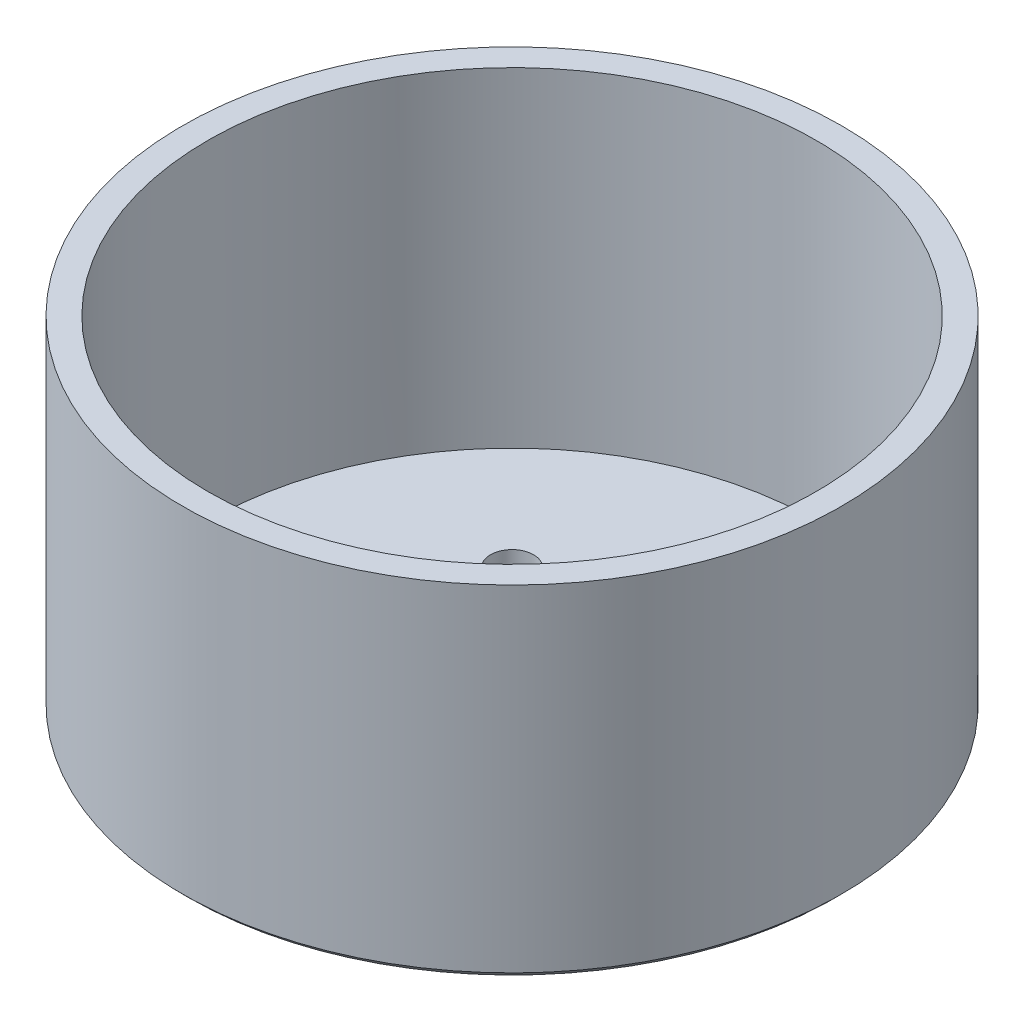
from build123d import *
from build123d.topology import SkipClean

# Parameters (mm, degrees)
SKETCH_1_R          = 26
SKETCH_1_R_2        = 24
EXTRUDE_1_DEPTH     = 26
EXTRUDE_START       = 1
SKETCH_2_R          = 26
EXTRUDE_2_DEPTH     = 1
CUT_EXTRUDE_4_REACH = 47.033
FILLET_2_R          = 4
EXTRUDE_START_2     = 0.7
EXTRUDE_3_DEPTH     = 0.7
CUT_EXTRUDE_1_REACH = 48.036
SKETCH_4_R          = 7
HOLE_WIZARD_M31_D   = 3.4
CHAMFER_1_SIZE      = 0.5


with BuildPart() as part:
    # Эскиз1 → Бобышка-Вытянуть1 (new body)
    with BuildSketch(Plane(origin=(0, 0, 0), x_dir=(1, 0, 0), z_dir=(0, 1, 0))):
        with Locations(Location((0, 0, 0), (0, 0, 90))):
            Circle(SKETCH_1_R)
        with Locations(Location((0, 0, 0), (0, 0, 90))):
            Circle(SKETCH_1_R_2, mode=Mode.SUBTRACT)
    extrude(amount=EXTRUDE_1_DEPTH)

    # Эскиз2 → Бобышка-Вытянуть2 (add)
    with BuildSketch(Plane.XZ.offset(EXTRUDE_START)):
        with Locations(Location((0, 0, 0), (0, 0, 270))):
            Circle(SKETCH_2_R)
    extrude(amount=-EXTRUDE_2_DEPTH)

    # Эскиз9 → Вырез-Вытянуть4 (cut, up to next)
    with BuildSketch(Plane(origin=(0, 0, 0), x_dir=(1, 0, 0), z_dir=(0, 1, 0)), mode=Mode.PRIVATE) as cut_extrude_4_sk1:
        with BuildLine():
            Line((15, 18.734993995), (15, -18.734993995))
            ThreePointArc((15, -18.734993995), (24, 0), (15, 18.734993995))
        make_face()
    cut_extrude_4_tool1 = extrude(cut_extrude_4_sk1.sketch, amount=-CUT_EXTRUDE_4_REACH, mode=Mode.PRIVATE) & part.part
    add(cut_extrude_4_tool1.solids().sort_by_distance((18.66496, 0, 0))[0], mode=Mode.SUBTRACT)

    # Скругление2
    fillet_2_edges = [part.edges().sort_by_distance(p)[0] for p in [
        (15, -0.5, -18.734993995),
        (15, -0.5, 18.734993995),
    ]]
    fillet(fillet_2_edges, radius=FILLET_2_R)

    # Эскиз3 → Бобышка-Вытянуть3 (add)
    with SkipClean():  # the faces are left unmerged after this step: merging them gives an invalid solid
        with BuildSketch(Plane.XZ.offset(1).offset(EXTRUDE_START_2)):
            with BuildLine():
                Line((15, -6.244997998), (15, 6.244997998))
                ThreePointArc((15, 6.244997998), (16.303590006, 9.199549257), (19.364686571, 10.22833877))
                ThreePointArc((19.364686571, 10.22833877), (-21.9, 0), (19.364686571, -10.22833877))
                ThreePointArc((19.364686571, -10.22833877), (16.303590006, -9.199549257), (15, -6.244997998))
            make_face()
        extrude(amount=-EXTRUDE_3_DEPTH)

    # Эскиз4 → Вырез-Вытянуть1 (cut, up to next)
    with BuildSketch(Plane.XZ.offset(1.7), mode=Mode.PRIVATE) as cut_extrude_1_sk1:
        with Locations(Location((0, 0, 0), (0, 0, 270))):
            Circle(SKETCH_4_R)
    cut_extrude_1_tool1 = extrude(cut_extrude_1_sk1.sketch, amount=-CUT_EXTRUDE_1_REACH, mode=Mode.PRIVATE) & part.part
    add(cut_extrude_1_tool1.solids().sort_by_distance((0, -1.7, 0))[0], mode=Mode.SUBTRACT)

    # Отверстие с зазором M31 (through all)
    with Locations(Plane(origin=(0, -1.7, 0), x_dir=(-1, 0, 0), z_dir=(0, -1, 0))):
        with Locations((8.838834765, -8.838834765), (-8.838834765, -8.838834765), (-8.838834765, 8.838834765), (8.838834765, 8.838834765)):
            Hole(HOLE_WIZARD_M31_D / 2)

    # Фаска1
    chamfer_1_edges = [part.edges().sort_by_distance(p)[0] for p in [
        (0, -1, 26),
    ]]
    chamfer(chamfer_1_edges, length=CHAMFER_1_SIZE)


solid = part.part
